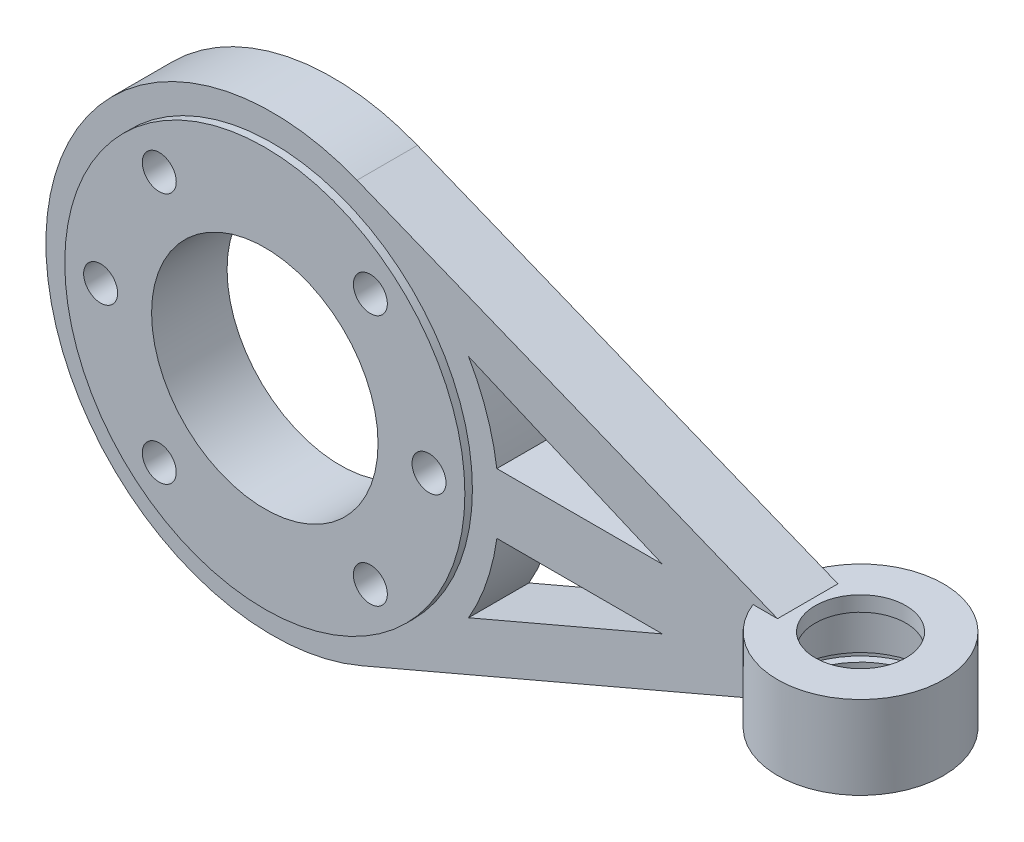
from build123d import *

# Parameters (mm, degrees)
SKETCH_1_R               = 30
EXTRUDE_1_DEPTH          = 3
SKETCH_2_W               = 11
SKETCH_2_H               = 11
EXTRUDE_2_DEPTH          = 4
SKETCH_4_R               = 6
CUT_EXTRUDE_1_DEPTH      = 25
SKETCH_5_R               = 9
CUT_EXTRUDE_2_DEPTH      = 9
CUT_EXTRUDE_START        = 7.85
SKETCH_6_R               = 10
SKETCH_6_R_2             = 9
CUT_EXTRUDE_3_DEPTH      = 1.1
SKETCH_8_R               = 26.5
EXTRUDE_3_DEPTH          = 5
CUT_EXTRUDE_4_DEPTH      = 92.299851037
CUT_EXTRUDE_4_DEPTH_BACK = 92.299851037
SKETCH_7_R               = 15
SKETCH_10_R              = 2.25
CUT_EXTRUDE_5_DEPTH      = 17


with BuildPart() as part:
    # 草图1 → 凸台-拉伸1 (new body)
    with BuildSketch(Plane.XY):
        Circle(SKETCH_1_R)
    extrude(amount=EXTRUDE_1_DEPTH)



with BuildPart() as body_2:
    # 草图2 → 旋转1 (revolve)
    with BuildSketch(Plane.XY.offset(3)):
        with Locations((68.415621645, -0.125)):
            Rectangle(SKETCH_2_W, SKETCH_2_H)
    revolve(axis=Axis((73.915621645, 22.717290725, 3), (0, -1, 0)))


with BuildPart() as part_1:
    add(part.part)

    add(body_2.part)  # 凸台-拉伸2 merges body 2
    # 草图3 → 凸台-拉伸2 (add, symmetric)
    with BuildSketch(Plane.XY.offset(3)):
        with BuildLine():
            Line((11.214731114, 27.824985284), (66.915621645, 5.375))
            Line((66.915621645, 5.375), (66.915621645, -4))
            Line((66.915621645, -4), (11.80104521, -27.581430926))
            ThreePointArc((11.80104521, -27.581430926), (-29.998320441, -0.317444067), (11.214731114, 27.824985284))
        make_face()
    extrude(amount=EXTRUDE_2_DEPTH, both=True)

    # 草图4 → 切除-拉伸1 (cut)
    with BuildSketch(Plane.XZ.offset(5.625)):
        with Locations(Location((73.915621645, 3, 0), (0, 0, 270))):
            Circle(SKETCH_4_R)
    extrude(amount=-CUT_EXTRUDE_1_DEPTH, mode=Mode.SUBTRACT)

    # 草图5 → 切除-拉伸2 (cut)
    with BuildSketch(Plane.XZ.offset(5.625)):
        with Locations(Location((73.915621645, 3, 0), (0, 0, 270))):
            Circle(SKETCH_5_R)
    extrude(amount=-CUT_EXTRUDE_2_DEPTH, mode=Mode.SUBTRACT)

    # 草图6 → 切除-拉伸3 (cut)
    # profile 1 of 2: a face of its own
    with BuildSketch(Plane.XZ.offset(-3.375).offset(CUT_EXTRUDE_START)):
        with Locations(Location((73.915621645, 3, 0), (0, 0, 270))):
            Circle(SKETCH_6_R)
        with Locations(Location((73.915621645, 3, 0), (0, 0, 270))):
            Circle(SKETCH_6_R_2, mode=Mode.SUBTRACT)
    # profile 2 of 2: a face of its own
    with BuildSketch(Plane.XZ.offset(-3.375).offset(CUT_EXTRUDE_START)):
        with Locations(Location((73.915621645, 3, 0), (0, 0, 270))):
            Circle(SKETCH_6_R_2)
    extrude(amount=-CUT_EXTRUDE_3_DEPTH, mode=Mode.SUBTRACT)

    # 草图8 → 凸台-拉伸3 (add, symmetric)
    with BuildSketch(Plane(origin=(0, 0, 3), x_dir=(-1, 0, 0), z_dir=(0, 0, -1))):
        with Locations(Location((0, 0, 0), (0, 0, 180))):
            Circle(SKETCH_8_R)
    extrude(amount=EXTRUDE_3_DEPTH, both=True)

    # 草图7 → 切除-拉伸4 (cut, two sides: drawn at the far end of the back side and taken through both)
    with BuildSketch(Plane.XY.offset(7).offset(-CUT_EXTRUDE_4_DEPTH_BACK)):
        with Locations(Location((0, 0, 0), (0, 0, 180))):
            Circle(SKETCH_7_R)
        with BuildLine():
            Line((25.989694724, -14.984517615), (51.662735414, -4))
            Line((51.662735414, -4), (29.732137495, -4))
            ThreePointArc((29.732137495, -4), (28.397104663, -9.674939108), (25.989694724, -14.984517615))
        make_face()
        with BuildLine():
            Line((29.732137495, 4), (51.662735414, 4))
            Line((51.662735414, 4), (25.989694724, 14.984517615))
            ThreePointArc((25.989694724, 14.984517615), (28.397104663, 9.674939108), (29.732137495, 4))
        make_face()
    extrude(amount=CUT_EXTRUDE_4_DEPTH + CUT_EXTRUDE_4_DEPTH_BACK, mode=Mode.SUBTRACT)

    # 草图10 → 切除-拉伸5 (cut)
    with BuildSketch(Plane.XY.offset(8)):
        with Locations((21.75, 0)):
            Circle(SKETCH_10_R)
        with Locations((13.980630511, -16.661466638)):
            Circle(SKETCH_10_R)
        with Locations(Location((-21.75, 0, 0), (0, 0, 180))):
            Circle(SKETCH_10_R)
        with Locations(Location((-13.980630511, -16.661466638, 0), (0, 0, 180))):
            Circle(SKETCH_10_R)
        with Locations(Location((13.980630511, 16.661466638, 0), (0, 0, 180))):
            Circle(SKETCH_10_R)
        with Locations((-13.980630511, 16.661466638)):
            Circle(SKETCH_10_R)
    extrude(amount=-CUT_EXTRUDE_5_DEPTH, mode=Mode.SUBTRACT)


solid = part_1.part
